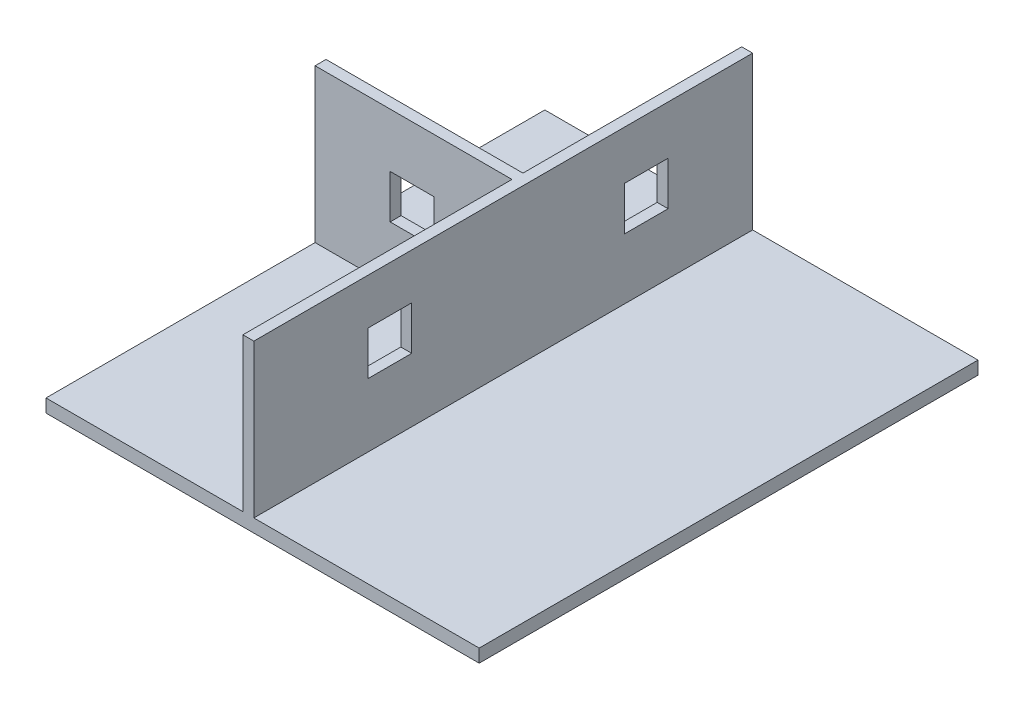
from build123d import *

# Parameters (mm, degrees)
SKETCH1_W           = 99
SKETCH1_H           = 114
BOSS_EXTRUDE1_DEPTH = 3
BOSS_EXTRUDE2_DEPTH = 35
SKETCH3_W           = 10
SKETCH3_H           = 10
CUT_EXTRUDE1_DEPTH  = 35
SKETCH4_W           = 10
SKETCH4_H           = 10
CUT_EXTRUDE2_DEPTH  = 35


with BuildPart() as part:
    # Sketch1 → Boss-Extrude1 (new body)
    with BuildSketch(Plane(origin=(0, 0, 0), x_dir=(1, 0, 0), z_dir=(0, 1, 0))):
        Rectangle(SKETCH1_W, SKETCH1_H)
    extrude(amount=BOSS_EXTRUDE1_DEPTH)

    # Sketch2 → Boss-Extrude2 (add)
    with BuildSketch(Plane(origin=(0, 3, 0), x_dir=(1, 0, 0), z_dir=(0, 1, 0))):
        Polygon((-2, 57), (-4.5, 57), (-4.5, 7), (-49.5, 7), (-49.5, 4.5), (-4.5, 4.5), (-4.5, -57), (-2, -57), align=None)
    extrude(amount=BOSS_EXTRUDE2_DEPTH)

    # Sketch3 → Cut-Extrude1 (cut)
    with BuildSketch(Plane.XY.offset(-4.5)):
        with Locations((-27.352089656, 20.663342565)):
            Rectangle(SKETCH3_W, SKETCH3_H)
    extrude(amount=-CUT_EXTRUDE1_DEPTH, mode=Mode.SUBTRACT)

    # Sketch4 → Cut-Extrude2 (cut)
    with BuildSketch(Plane.ZY.offset(4.5)):
        with Locations((-32.678506246, 21.863269453)):
            Rectangle(SKETCH4_W, SKETCH4_H)
        with Locations((25.912956103, 22.537357248)):
            Rectangle(SKETCH4_W, SKETCH4_H)
    extrude(amount=-CUT_EXTRUDE2_DEPTH, mode=Mode.SUBTRACT)


solid = part.part
